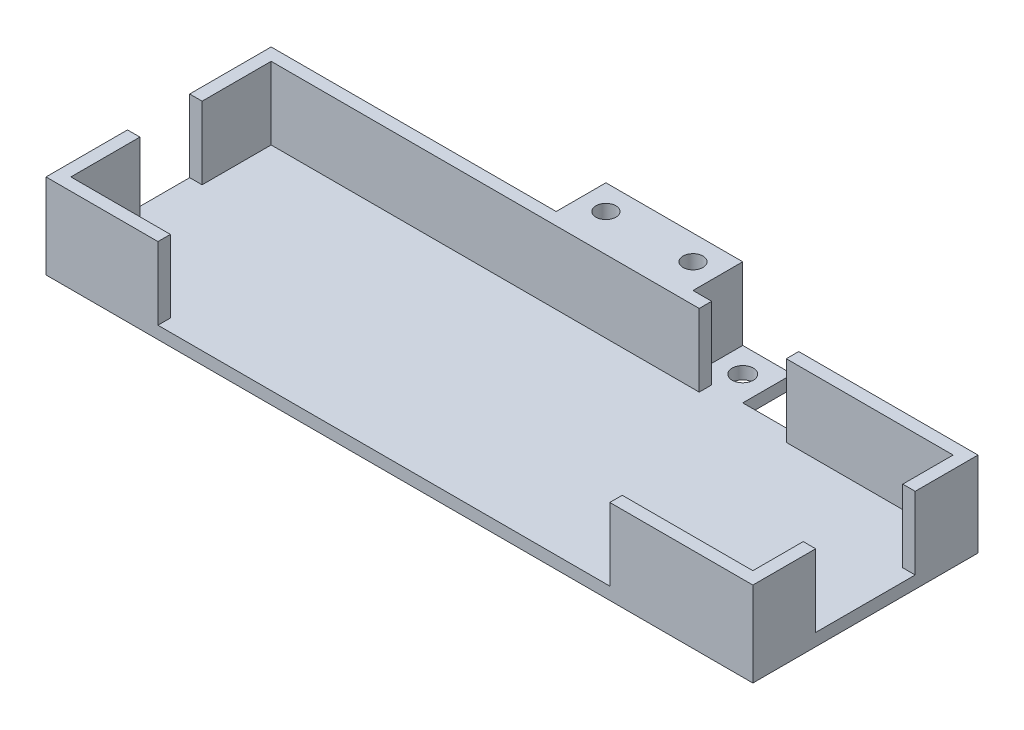
from build123d import *

# Parameters (mm, degrees)
SKETCH1_W           = 113.65
SKETCH1_H           = 36.2
SKETCH1_W_2         = 109.65
SKETCH1_H_2         = 32.2
SKETCH1_W_3         = 107.65
SKETCH1_H_3         = 30.2
BOSS_EXTRUDE1_DEPTH = 2
BOSS_EXTRUDE2_DEPTH = 11.65
SKETCH3_W           = 38
SKETCH3_H           = 8
SKETCH3_R           = 1.7
BOSS_EXTRUDE3_DEPTH = 2
SKETCH4_W           = 22
SKETCH4_H           = 8
SKETCH4_R           = 1.6
BOSS_EXTRUDE4_DEPTH = 11.65
SKETCH5_W           = 14
SKETCH5_H           = 2
CUT_EXTRUDE1_DEPTH  = 11.65


with BuildPart() as part:
    # Sketch1 → Boss-Extrude1 (new body)
    # profile 1 of 3: a face of its own
    with BuildSketch(Plane(origin=(0, 0, 0), x_dir=(1, 0, 0), z_dir=(0, 1, 0))):
        with Locations((53.825, 15.1)):
            Rectangle(SKETCH1_W, SKETCH1_H)
        with Locations((53.825, 15.1)):
            Rectangle(SKETCH1_W_2, SKETCH1_H_2, mode=Mode.SUBTRACT)
    # profile 2 of 3: a face of its own
    with BuildSketch(Plane(origin=(0, 0, 0), x_dir=(1, 0, 0), z_dir=(0, 1, 0))):
        with Locations((53.825, 15.1)):
            Rectangle(SKETCH1_W_2, SKETCH1_H_2)
        with Locations((53.825, 15.1)):
            Rectangle(SKETCH1_W_3, SKETCH1_H_3, mode=Mode.SUBTRACT)
    # profile 3 of 3: a face of its own
    with BuildSketch(Plane(origin=(0, 0, 0), x_dir=(1, 0, 0), z_dir=(0, 1, 0))):
        with Locations((53.825, 15.1)):
            Rectangle(SKETCH1_W_3, SKETCH1_H_3)
    extrude(amount=BOSS_EXTRUDE1_DEPTH)

    # Sketch2 → Boss-Extrude2 (add)
    with BuildSketch(Plane(origin=(0, 2, 0), x_dir=(1, 0, 0), z_dir=(0, 1, 0))):
        Polygon((15, -1), (15, -3), (-3, -3), (-3, 10.1), (-1, 10.1), (-1, -1), align=None)
        Polygon((-1, 20.1), (-3, 20.1), (-3, 33.2), (110.65, 33.2), (110.65, 23.1), (108.65, 23.1), (108.65, 31.2), (-1, 31.2), align=None)
        Polygon((108.65, -1), (108.65, 7.1), (110.65, 7.1), (110.65, -3), (87.65, -3), (87.65, -1), align=None)
    extrude(amount=BOSS_EXTRUDE2_DEPTH)

    # Sketch3 → Boss-Extrude3 (add)
    with BuildSketch(Plane.XZ):
        with Locations((53.825, -37.2)):
            Rectangle(SKETCH3_W, SKETCH3_H)
        with Locations(Location((68.825, -37.2, 0), (0, 0, 90))):
            Circle(SKETCH3_R, mode=Mode.SUBTRACT)
        with Locations(Location((38.825, -37.2, 0), (0, 0, 90))):
            Circle(SKETCH3_R, mode=Mode.SUBTRACT)
    extrude(amount=-BOSS_EXTRUDE3_DEPTH)

    # Sketch4 → Boss-Extrude4 (add)
    with BuildSketch(Plane(origin=(0, 2, 0), x_dir=(1, 0, 0), z_dir=(0, 1, 0))):
        with Locations((53.825, 37.2)):
            Rectangle(SKETCH4_W, SKETCH4_H)
        with Locations(Location((46.825, 37.2, 0), (0, 0, 270))):
            Circle(SKETCH4_R, mode=Mode.SUBTRACT)
        with Locations(Location((60.825, 37.2, 0), (0, 0, 90))):
            Circle(SKETCH4_R, mode=Mode.SUBTRACT)
    extrude(amount=BOSS_EXTRUDE4_DEPTH)

    # Sketch5 → Cut-Extrude1 (cut)
    with BuildSketch(Plane(origin=(0, 13.65, 0), x_dir=(1, 0, 0), z_dir=(0, 1, 0))):
        with Locations((74.825, 32.2)):
            Rectangle(SKETCH5_W, SKETCH5_H)
    extrude(amount=-CUT_EXTRUDE1_DEPTH, mode=Mode.SUBTRACT)


solid = part.part
